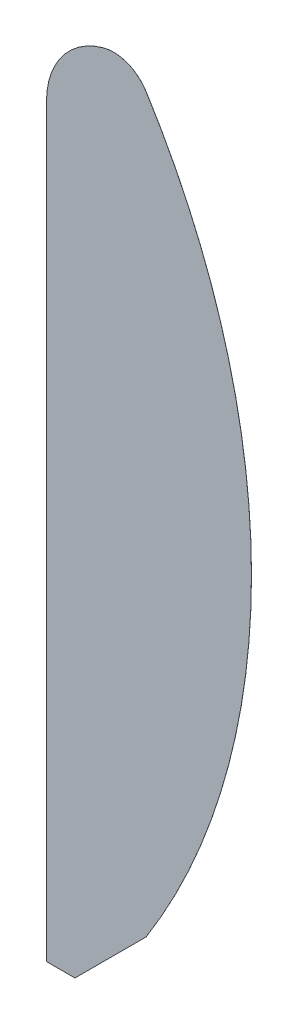
from build123d import *

# Parameters (mm, degrees)
BOSS_EXTRUDE1_DEPTH = 0.01


with BuildPart() as part:
    # Sketch1 → Boss-Extrude1 (new body)
    with BuildSketch(Plane(origin=(0, 0, 0), x_dir=(0, 1, 0), z_dir=(0, 0, 1))):
        with BuildLine():
            Line((0, 0), (130.896, 0))
            ThreePointArc((130.896, 0), (139.137887163, -2.785571862), (144, -10))
            ThreePointArc((144, -10), (143.778489537, -14.233355018), (141.07675081, -17.5))
            ThreePointArc((141.07675081, -17.5), (76.788375405, -36), (12.5, -17.5))
            Line((12.5, -17.5), (0, -5))
            Line((0, -5), (0, 0))
        make_face()
    extrude(amount=BOSS_EXTRUDE1_DEPTH)


solid = part.part
